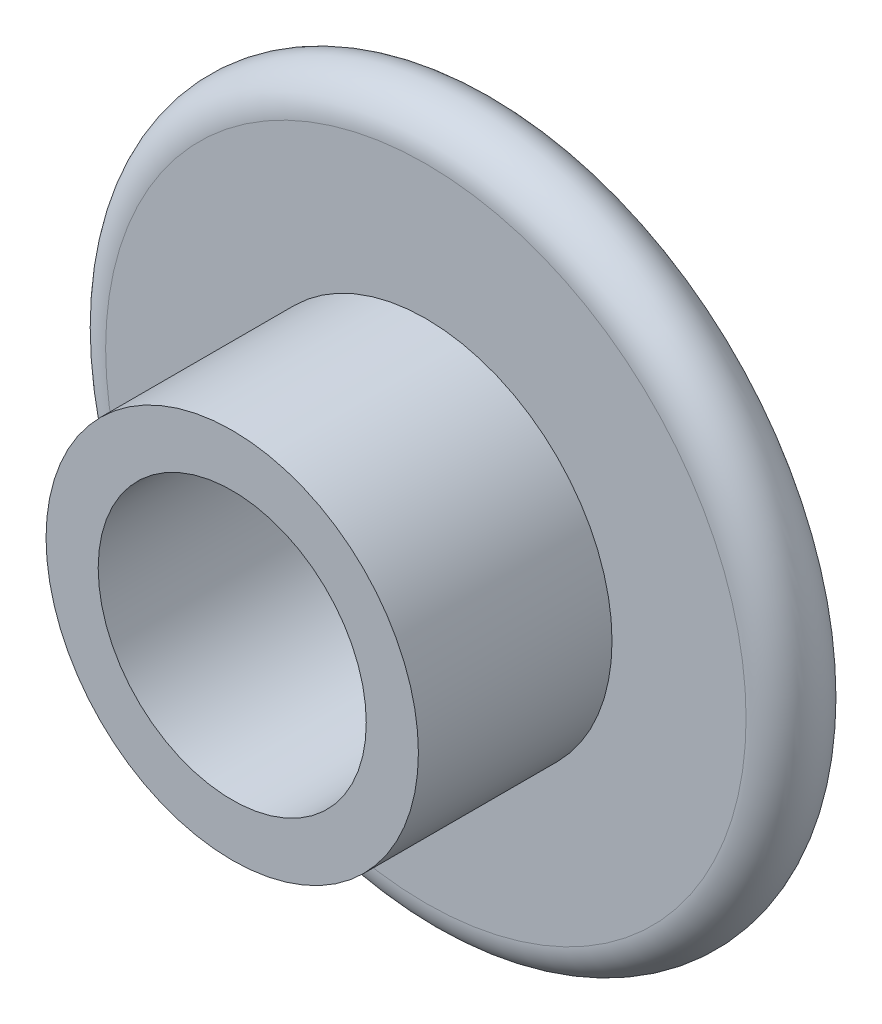
from build123d import *


with BuildPart() as part:
    # Sketch1 → Revolve1 (revolve)
    with BuildSketch(Plane(origin=(0, 0, 0), x_dir=(1, 0, 0), z_dir=(0, 1, 0)), mode=Mode.PRIVATE) as revolve1_sk:
        with BuildLine():
            Line((25, 0), (25, 26))
            Line((25, 26), (43, 26))
            ThreePointArc((43, 26), (48, 31), (43, 36))
            Line((43, 36), (25, 36))
            Line((25, 36), (25, 46))
            Line((25, 46), (18, 46))
            Line((18, 46), (18, 0))
            Line((18, 0), (25, 0))
        make_face()
    revolve(revolve1_sk.sketch.rotate(Axis((0, 0, -73.982194402), (0, 0, 1)), 180), axis=Axis((0, 0, -73.982194402), (0, 0, 1)))


solid = part.part
